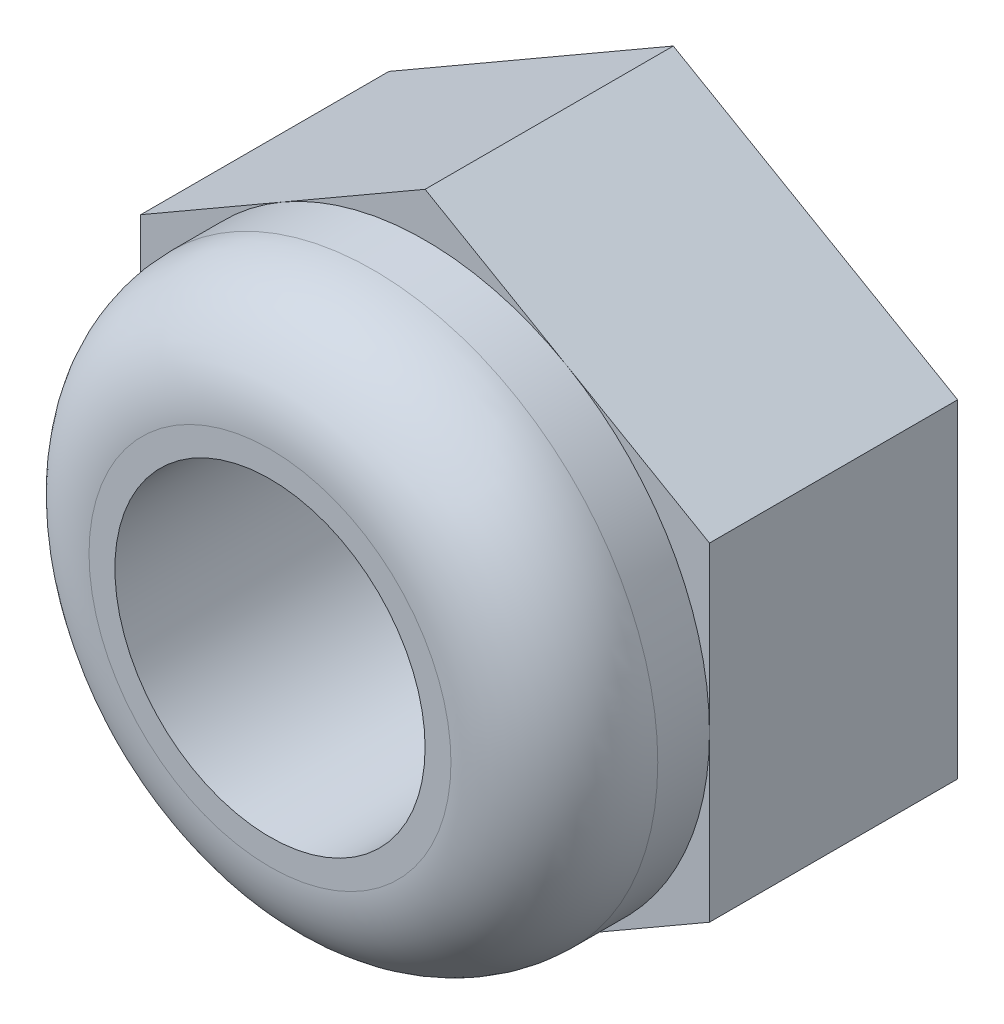
from build123d import *

# Parameters (mm, degrees)
EXTRUDE_1_DEPTH     = 2.4
SKETCH_3_R          = 2.75
EXTRUDE_2_DEPTH     = 1.5
FILLET_1_R          = 1
SKETCH_4_R          = 1.5
CUT_EXTRUDE_1_DEPTH = 9.5


with BuildPart() as part:
    # 草图2 → 凸台-拉伸1 (new body)
    with BuildSketch(Plane.XY):
        Polygon((2.75, -1.58771324), (2.75, 1.58771324), (0, 3.175426481), (-2.75, 1.58771324), (-2.75, -1.58771324), (0, -3.175426481), align=None)
    extrude(amount=EXTRUDE_1_DEPTH)

    # 草图3 → 凸台-拉伸2 (add)
    with BuildSketch(Plane.XY.offset(2.4)):
        Circle(SKETCH_3_R)
    extrude(amount=EXTRUDE_2_DEPTH)

    # 圆角1
    fillet_1_edges = [part.edges().sort_by_distance(p)[0] for p in [
        (-2.75, 0, 3.9),
    ]]
    fillet(fillet_1_edges, radius=FILLET_1_R)

    # 草图4 → 切除-拉伸1 (cut)
    with BuildSketch(Plane.XY.offset(3.9)):
        Circle(SKETCH_4_R)
    extrude(amount=-CUT_EXTRUDE_1_DEPTH, mode=Mode.SUBTRACT)


solid = part.part
